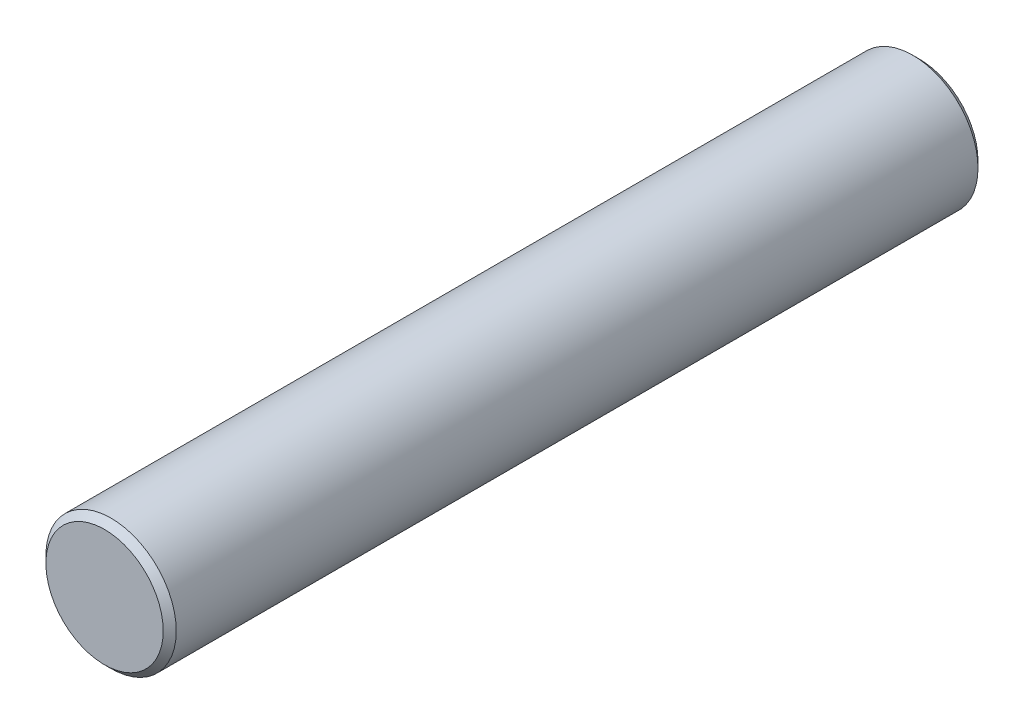
from build123d import *

# Parameters (mm, degrees)
SKETCH_1_R      = 10
EXTRUDE_1_DEPTH = 125
CHAMFER_1_SIZE  = 1


with BuildPart() as part:
    # Эскиз1 → Бобышка-Вытянуть1 (new body)
    with BuildSketch(Plane.XY):
        Circle(SKETCH_1_R)
    extrude(amount=EXTRUDE_1_DEPTH)

    # Фаска1
    chamfer_1_edges = [part.edges().sort_by_distance(p)[0] for p in [
        (-10, 0, 0),
        (-10, 0, 125),
    ]]
    chamfer(chamfer_1_edges, length=CHAMFER_1_SIZE)


solid = part.part
